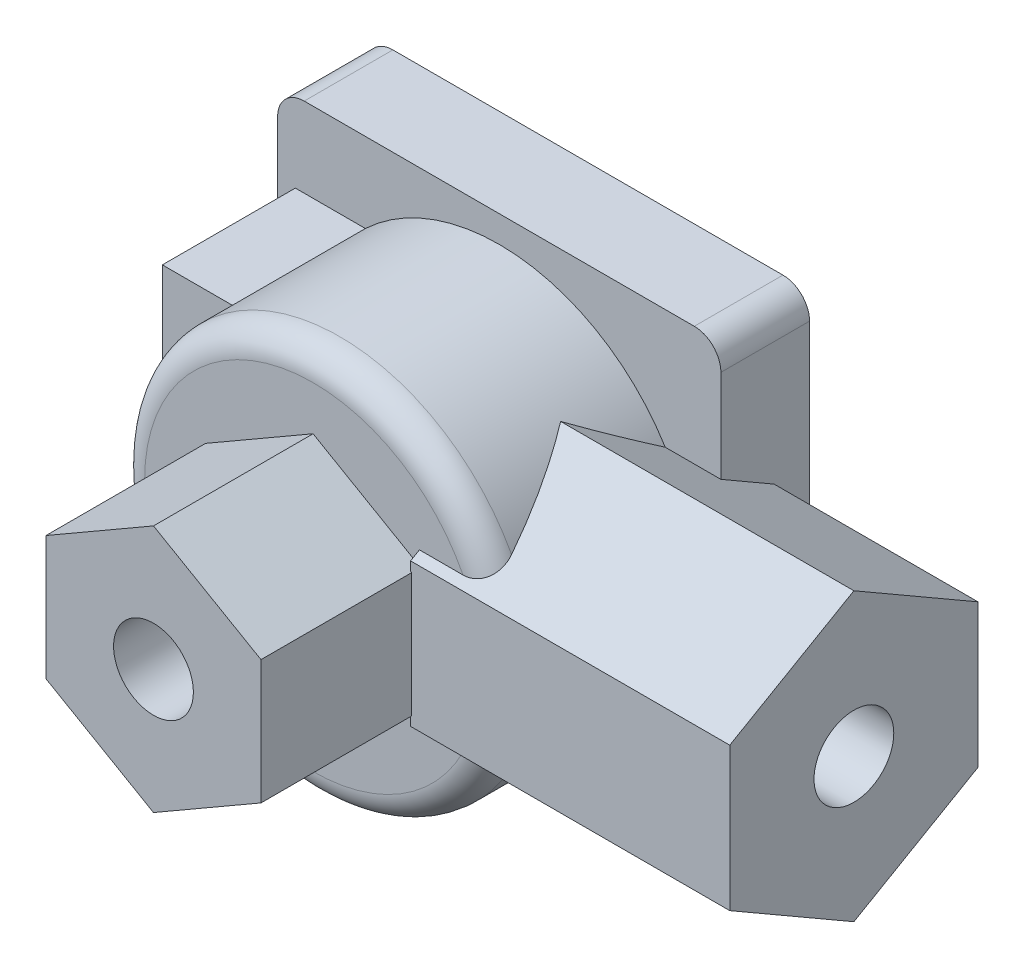
from build123d import *

# Parameters (mm, degrees)
SKETCH1_W           = 50
SKETCH1_H           = 50
BOSS_EXTRUDE1_DEPTH = 10
SKETCH2_R           = 22
BOSS_EXTRUDE2_DEPTH = 21
BOSS_EXTRUDE3_DEPTH = 18
SKETCH4_R           = 4.5
CUT_EXTRUDE1_DEPTH  = 87.029064856
BOSS_EXTRUDE4_START = -9
SKETCH6_W           = 8
SKETCH6_H           = 15
BOSS_EXTRUDE4_DEPTH = 32
BOSS_EXTRUDE5_DEPTH = 36
SKETCH12_R          = 4.5
CUT_EXTRUDE2_DEPTH  = 48
FILLET1_R           = 3
FILLET2_R           = 3


with BuildPart() as part:
    # Sketch1 → Boss-Extrude1 (new body)
    with BuildSketch(Plane.XY):
        with Locations((25, 25)):
            Rectangle(SKETCH1_W, SKETCH1_H)
    extrude(amount=BOSS_EXTRUDE1_DEPTH)

    # Sketch2 → Boss-Extrude2 (add)
    with BuildSketch(Plane.XY.offset(10)):
        with Locations(Location((25, 25, 0), (0, 0, 180))):
            Circle(SKETCH2_R)
    extrude(amount=BOSS_EXTRUDE2_DEPTH)

    # Sketch3 → Boss-Extrude3 (add)
    with BuildSketch(Plane.XY.offset(31)):
        Polygon((25, 11), (37.124355653, 18), (37.124355653, 32), (25, 39), (12.875644347, 32), (12.875644347, 18), align=None)
    extrude(amount=BOSS_EXTRUDE3_DEPTH)

    # Sketch4 → Cut-Extrude1 (cut, through all)
    with BuildSketch(Plane.XY.offset(49)):
        with Locations((25, 25)):
            Circle(SKETCH4_R)
    extrude(amount=-CUT_EXTRUDE1_DEPTH, mode=Mode.SUBTRACT)

    # Sketch6 → Boss-Extrude4 (add)
    with BuildSketch(Plane.XZ.offset(BOSS_EXTRUDE4_START)):
        with Locations((6, 17.5)):
            Rectangle(SKETCH6_W, SKETCH6_H)
    extrude(amount=-BOSS_EXTRUDE4_DEPTH)

    # Sketch10 → Boss-Extrude5 (add)
    with BuildSketch(Plane(origin=(73, 0, 0), x_dir=(0, 0, -1), z_dir=(1, 0, 0))):
        Polygon((-4, 16.917096231), (-4, 33.082903769), (-18, 41.165807537), (-32, 33.082903769), (-32, 16.917096231), (-18, 8.834192463), align=None)
    extrude(amount=-BOSS_EXTRUDE5_DEPTH)

    # Sketch12 → Cut-Extrude2 (cut)
    with BuildSketch(Plane(origin=(73, 0, 0), x_dir=(0, 0, -1), z_dir=(1, 0, 0))):
        with Locations((-18, 25)):
            Circle(SKETCH12_R)
    extrude(amount=-CUT_EXTRUDE2_DEPTH, mode=Mode.SUBTRACT)

    # Fillet1
    fillet1_edges = [part.edges().sort_by_distance(p)[0] for p in [
        (3, 25, 31),
    ]]
    fillet(fillet1_edges, radius=FILLET1_R)

    # Fillet2
    fillet2_edges = [part.edges().sort_by_distance(p)[0] for p in [
        (0, 50, 5),
        (50, 50, 5),
        (50, 0, 5),
        (0, 0, 5),
    ]]
    fillet(fillet2_edges, radius=FILLET2_R)


solid = part.part
